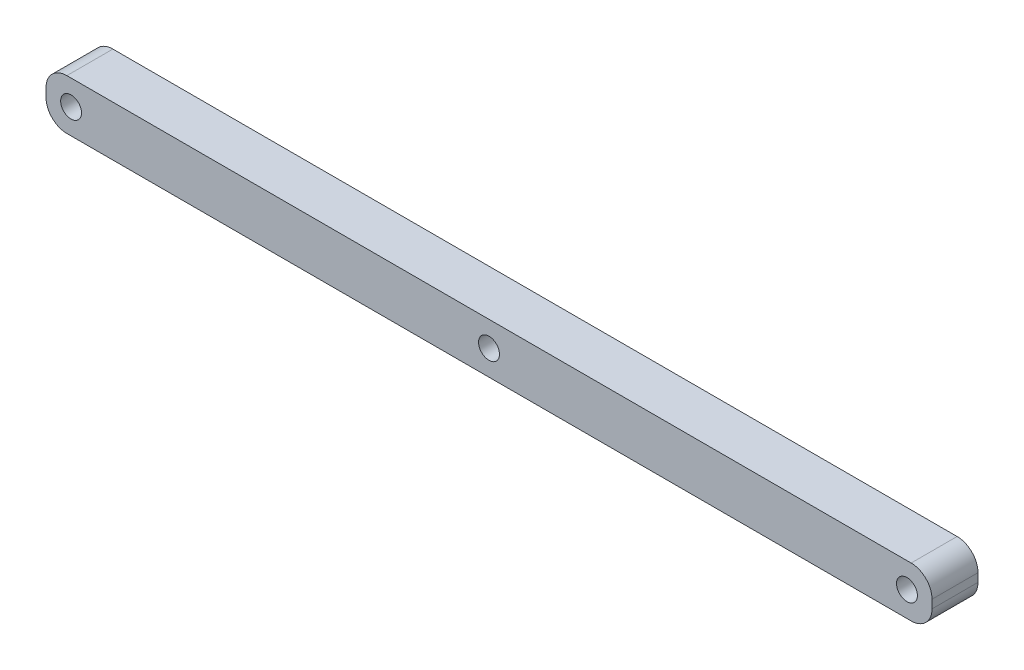
from build123d import *

# Parameters (mm, degrees)
SKETCH1_W           = 424
SKETCH1_H           = 24
SKETCH1_R           = 5
BOSS_EXTRUDE1_DEPTH = 22
FILLET1_R           = 10


with BuildPart() as part:
    # Sketch1 → Boss-Extrude1 (new body)
    with BuildSketch(Plane.XY):
        with Locations((212, 12)):
            Rectangle(SKETCH1_W, SKETCH1_H)
        with Locations((12, 12)):
            Circle(SKETCH1_R, mode=Mode.SUBTRACT)
        with Locations((412, 12)):
            Circle(SKETCH1_R, mode=Mode.SUBTRACT)
        with Locations((212, 12)):
            Circle(SKETCH1_R, mode=Mode.SUBTRACT)
    extrude(amount=BOSS_EXTRUDE1_DEPTH)

    # Fillet1
    fillet1_edges = [part.edges().sort_by_distance(p)[0] for p in [
        (0, 24, 11),
        (424, 24, 11),
        (424, 0, 11),
        (0, 0, 11),
    ]]
    fillet(fillet1_edges, radius=FILLET1_R)


solid = part.part
